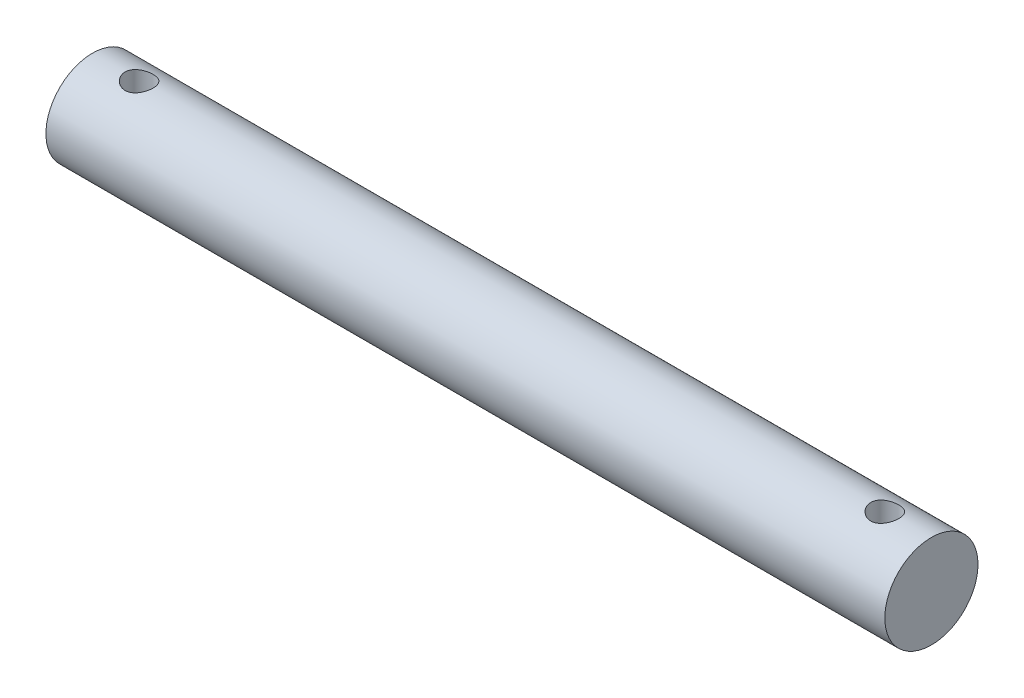
from build123d import *

# Parameters (mm, degrees)
SKETCH1_R           = 5
BOSS_EXTRUDE1_DEPTH = 45
SKETCH4_R           = 1.5
CUT_EXTRUDE1_DEPTH  = 46.552167896


with BuildPart() as part:
    # Sketch1 → Boss-Extrude1 (new, symmetric)
    with BuildSketch(Plane(origin=(0, 0, 0), x_dir=(0, 0, -1), z_dir=(1, 0, 0))):
        Circle(SKETCH1_R)
    extrude(amount=BOSS_EXTRUDE1_DEPTH, both=True)

    # Sketch4 → Cut-Extrude1 (cut, symmetric)
    with BuildSketch(Plane(origin=(0, 0, 0), x_dir=(1, 0, 0), z_dir=(0, 1, 0))):
        with Locations((-40, 0)):
            Circle(SKETCH4_R)
    cut_extrude1 = extrude(amount=CUT_EXTRUDE1_DEPTH, both=True, mode=Mode.SUBTRACT)

    # Mirror1: Cut-Extrude1 across plane
    add(cut_extrude1.mirror(Plane(origin=(0, 0, 0), x_dir=(0, 0, 1), z_dir=(1, 0, 0))), mode=Mode.SUBTRACT)


solid = part.part
